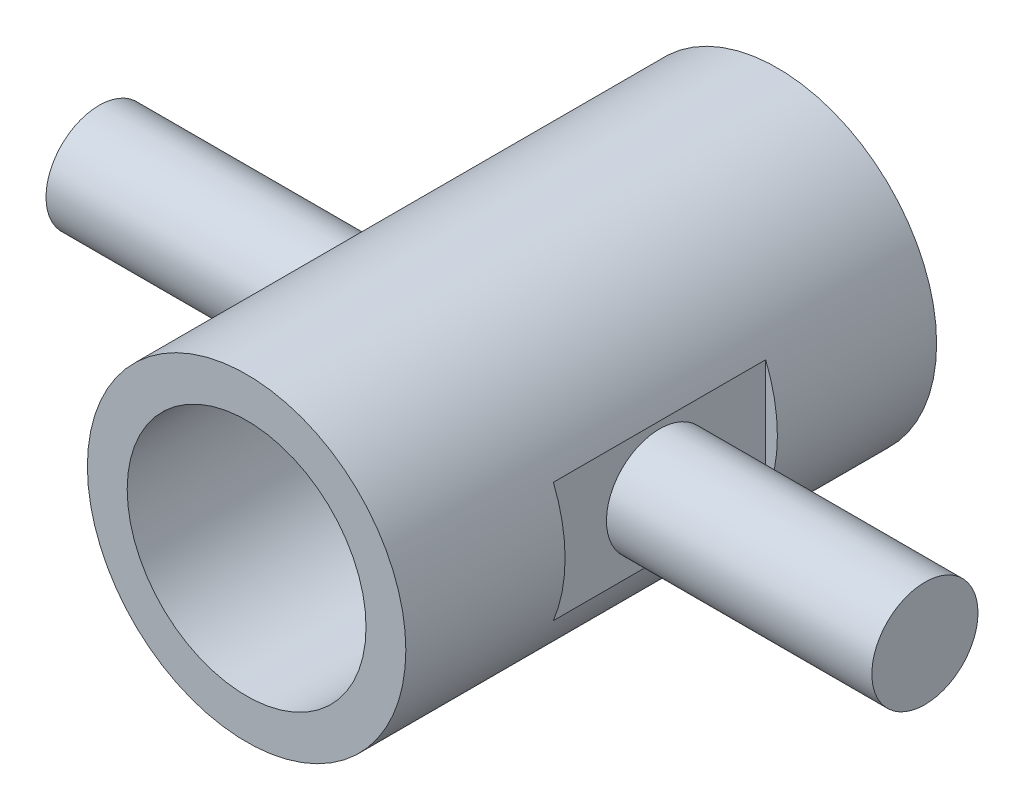
from build123d import *

# Parameters (mm, degrees)
SKETCH1_R           = 3
SKETCH1_R_2         = 2.25
BOSS_EXTRUDE1_DEPTH = 10
CUT_EXTRUDE3_START  = -3
SKETCH2_W           = 1.120885769
SKETCH2_H           = 2.257305728
CUT_EXTRUDE3_DEPTH  = 4
SKETCH3_R           = 1
BOSS_EXTRUDE2_DEPTH = 5
BOSS_EXTRUDE3_START = 5
SKETCH4_R           = 1
BOSS_EXTRUDE3_DEPTH = 5


with BuildPart() as part:
    # Sketch1 → Boss-Extrude1 (new body)
    with BuildSketch(Plane.XY):
        Circle(SKETCH1_R)
        Circle(SKETCH1_R_2, mode=Mode.SUBTRACT)
    extrude(amount=BOSS_EXTRUDE1_DEPTH)

    # Sketch2 → Cut-Extrude3 (cut)
    with BuildSketch(Plane.XY.offset(10).offset(CUT_EXTRUDE3_START)):
        with Locations((-3.340036868, 0)):
            Rectangle(SKETCH2_W, SKETCH2_H)
        with Locations((3.340036868, 0)):
            Rectangle(SKETCH2_W, SKETCH2_H)
    extrude(amount=-CUT_EXTRUDE3_DEPTH, mode=Mode.SUBTRACT)

    # Sketch3 → Boss-Extrude2 (add)
    with BuildSketch(Plane.ZY.offset(2.779593983)):
        with Locations(Location((5, 0, 0), (0, 0, 90))):
            Circle(SKETCH3_R)
    extrude(amount=BOSS_EXTRUDE2_DEPTH)

    # Sketch4 → Boss-Extrude3 (add)
    with BuildSketch(Plane(origin=(2.779593983, 0, 0), x_dir=(0, 0, -1), z_dir=(1, 0, 0)).offset(BOSS_EXTRUDE3_START)):
        with Locations(Location((-5, 0, 0), (0, 0, 90))):
            Circle(SKETCH4_R)
    extrude(amount=-BOSS_EXTRUDE3_DEPTH)


solid = part.part
